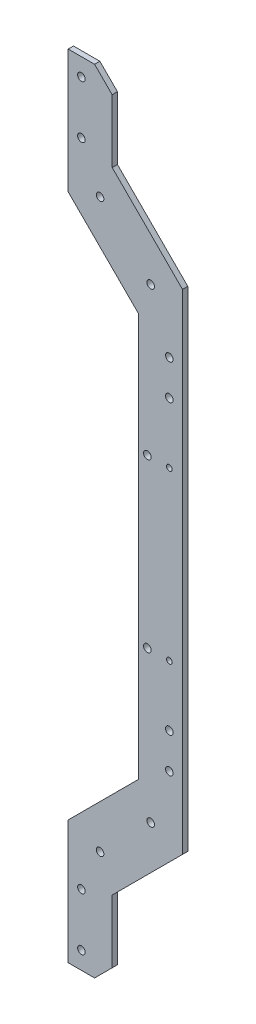
from build123d import *

# Parameters (mm, degrees)
BOSS_EXTRUDE1_DEPTH = 3
BOSS_EXTRUDE2_DEPTH = 3
CHAMFER1_SIZE       = 10
SKETCH3_R           = 2.15
SKETCH3_R_2         = 1.6
CUT_EXTRUDE1_DEPTH  = 10
SKETCH4_R           = 2.15
CUT_EXTRUDE2_DEPTH  = 10


with BuildPart() as part:
    # Sketch1 → Boss-Extrude1 (new body)
    with BuildSketch(Plane.XY):
        Polygon((-372.700177837, -225), (-357.700177837, -225), (-347.700177837, -225), (-347.700177837, -179.142135624), (-307.700177837, -139.142135624), (-307.700177837, -125), (-307.700177837, 125), (-307.700177837, 139.142135624), (-347.700177837, 179.142135624), (-347.700177837, 225), (-357.700177837, 225), (-372.700177837, 225), (-372.700177837, 168.786796564), (-332.700177837, 128.786796564), (-332.700177837, -128.786796564), (-372.700177837, -168.786796564), align=None)
    extrude(amount=BOSS_EXTRUDE1_DEPTH)

    # Sketch2 → Boss-Extrude2 (add)
    with BuildSketch(Plane.XY.offset(3)):
        Polygon((-372.700177837, 168.786796564), (-372.700177837, 154.644660941), (-332.700177837, 114.644660941), (-332.700177837, 128.786796564), align=None)
        Polygon((-372.700177837, -168.786796564), (-372.700177837, -154.644660941), (-332.700177837, -114.644660941), (-332.700177837, -128.786796564), align=None)
    extrude(amount=-BOSS_EXTRUDE2_DEPTH)

    # Chamfer1
    chamfer1_edges = [part.edges().sort_by_distance(p)[0] for p in [
        (-347.700177837, 225, 1.5),
        (-347.700177837, -225, 1.5),
    ]]
    chamfer(chamfer1_edges, length=CHAMFER1_SIZE)

    # Sketch3 → Cut-Extrude1 (cut)
    with BuildSketch(Plane.XY.offset(3)):
        with Locations((-327.700177837, 47.5)):
            Circle(SKETCH3_R)
        with Locations((-315.200177837, 47.5)):
            Circle(SKETCH3_R_2)
        with Locations((-327.700177837, -47.5)):
            Circle(SKETCH3_R)
        with Locations((-315.200177837, -47.5)):
            Circle(SKETCH3_R_2)
    extrude(amount=-CUT_EXTRUDE1_DEPTH, mode=Mode.SUBTRACT)

    # Sketch4 → Cut-Extrude2 (cut)
    with BuildSketch(Plane(origin=(0, 0, 0), x_dir=(-1, 0, 0), z_dir=(0, 0, -1))):
        with Locations((365.200177837, 215)):
            Circle(SKETCH4_R)
        with Locations((365.200177837, 185)):
            Circle(SKETCH4_R)
        with Locations((354.593576119, 161.286796564)):
            Circle(SKETCH4_R)
        with Locations((325.806779555, 132.5)):
            Circle(SKETCH4_R)
        with Locations((315.200177837, 101.893398282)):
            Circle(SKETCH4_R)
        with Locations((315.200177837, 81.893398282)):
            Circle(SKETCH4_R)
        with Locations(Location((315.200177837, -81.893398282, 0), (0, 0, 180))):
            Circle(SKETCH4_R)
        with Locations(Location((315.200177837, -101.893398282, 0), (0, 0, 180))):
            Circle(SKETCH4_R)
        with Locations(Location((325.806779555, -132.5, 0), (0, 0, 180))):
            Circle(SKETCH4_R)
        with Locations(Location((354.593576119, -161.286796564, 0), (0, 0, 180))):
            Circle(SKETCH4_R)
        with Locations(Location((365.200177837, -185, 0), (0, 0, 180))):
            Circle(SKETCH4_R)
        with Locations(Location((365.200177837, -215, 0), (0, 0, 180))):
            Circle(SKETCH4_R)
    extrude(amount=-CUT_EXTRUDE2_DEPTH, mode=Mode.SUBTRACT)


solid = part.part
